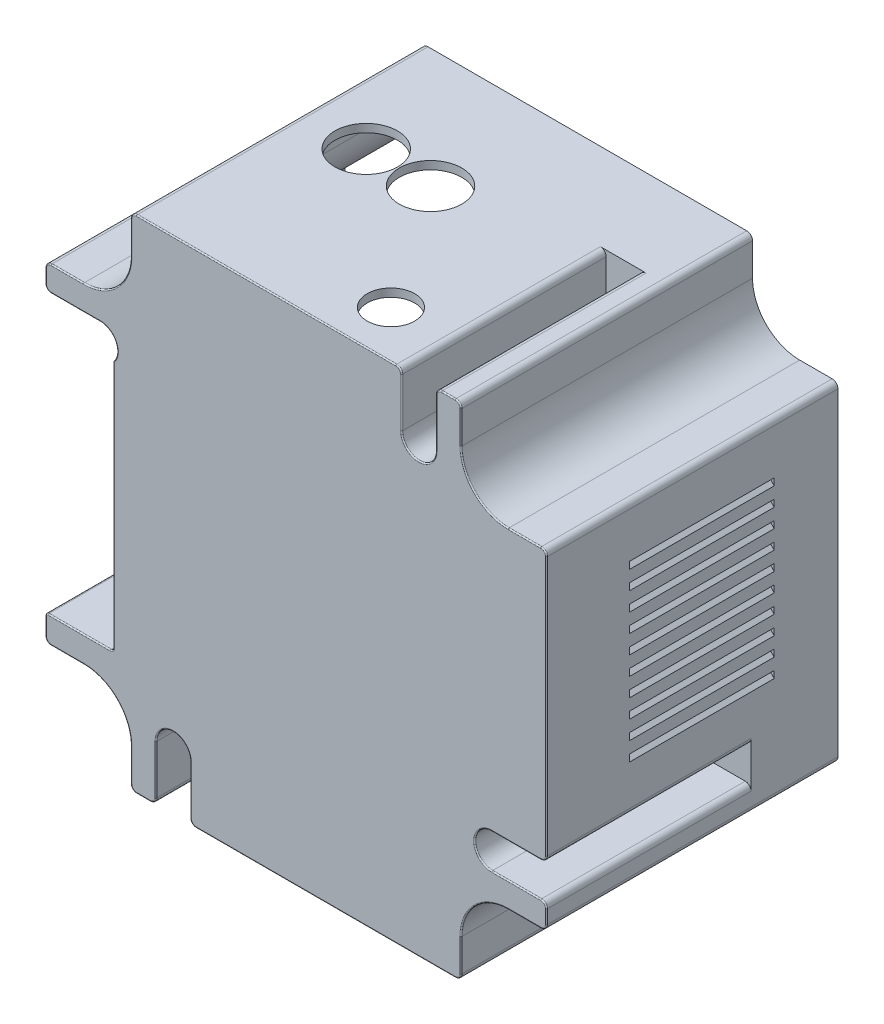
from build123d import *

# Parameters (mm, degrees)
EXTRUDE_1_DEPTH     = 50.3
SHELL_1_T           = -1.4
CUT_EXTRUDE_1_DEPTH = 35.3
EXTRUDE_2_DEPTH     = 35.3
SKETCH_5_R          = 1.65
EXTRUDE_2_2_DEPTH   = 4
CUT_EXTRUDE_2_DEPTH = 25
SKETCH_7_W          = 12.8
SKETCH_7_H          = 44.5
CUT_EXTRUDE_3_DEPTH = 34.3
CUT_EXTRUDE_4_REACH = 111.009
SKETCH_8_R          = 5.4
SKETCH_8_R_2        = 4.1
EXTRUDE_3_REACH     = 96.463
SKETCH_10_W         = 12.8
SKETCH_10_H         = 34
EXTRUDE_5_DEPTH     = 1.1
CUT_EXTRUDE_START   = 35.3
CUT_EXTRUDE_5_DEPTH = 35.3
SKETCH_13_R         = 1.65
CUT_EXTRUDE_7_DEPTH = 71.620216652
CUT_EXTRUDE_6_REACH = 101.978
SKETCH_12_W         = 14.5
SKETCH_12_H         = 12.3
FILLET_1_R          = 0.5
FILLET_3_R          = 0.2
CUT_EXTRUDE_8_DEPTH = 25


with BuildPart() as part:
    # 草图1 → 凸台-拉伸1 (new body)
    with BuildSketch(Plane.XY):
        with BuildLine():
            Line((-27.5, 43.25), (27.5, 43.25))
            ThreePointArc((27.5, 43.25), (28.207106781, 42.957106781), (28.5, 42.25))
            Line((28.5, 42.25), (28.5, 36.65))
            ThreePointArc((28.5, 36.65), (30.887079733, 30.887079733), (36.65, 28.5))
            Line((36.65, 28.5), (42.25, 28.5))
            ThreePointArc((42.25, 28.5), (42.957106781, 28.207106781), (43.25, 27.5))
            Line((43.25, 27.5), (43.25, -27.5))
            ThreePointArc((43.25, -27.5), (42.957106781, -28.207106781), (42.25, -28.5))
            Line((42.25, -28.5), (36.65, -28.5))
            ThreePointArc((36.65, -28.5), (30.887079733, -30.887079733), (28.5, -36.65))
            Line((28.5, -36.65), (28.5, -42.25))
            ThreePointArc((28.5, -42.25), (28.207106781, -42.957106781), (27.5, -43.25))
            Line((27.5, -43.25), (-27.5, -43.25))
            ThreePointArc((-27.5, -43.25), (-28.207106781, -42.957106781), (-28.5, -42.25))
            Line((-28.5, -42.25), (-28.5, -36.65))
            ThreePointArc((-28.5, -36.65), (-30.887079733, -30.887079733), (-36.65, -28.5))
            Line((-36.65, -28.5), (-42.25, -28.5))
            ThreePointArc((-42.25, -28.5), (-42.957106781, -28.207106781), (-43.25, -27.5))
            Line((-43.25, -27.5), (-43.25, 27.5))
            ThreePointArc((-43.25, 27.5), (-42.957106781, 28.207106781), (-42.25, 28.5))
            Line((-42.25, 28.5), (-36.65, 28.5))
            ThreePointArc((-36.65, 28.5), (-30.887079733, 30.887079733), (-28.5, 36.65))
            Line((-28.5, 36.65), (-28.5, 42.25))
            ThreePointArc((-28.5, 42.25), (-28.207106781, 42.957106781), (-27.5, 43.25))
        make_face()
    extrude(amount=EXTRUDE_1_DEPTH)

    # 抽壳1
    shell_1_openings = [part.faces().sort_by_distance(p)[0] for p in [
        (0, 0, 0),
    ]]
    offset(amount=SHELL_1_T, openings=shell_1_openings)

    # 草图2 → 切除-拉伸1 (cut)
    with BuildSketch(Plane.XY.offset(50.3)):
        with BuildLine():
            Line((-33.80515662, 24.14484338), (-42.25, 24.14484338))
            ThreePointArc((-42.25, 24.14484338), (-42.957106781, 24.437736599), (-43.25, 25.14484338))
            Line((-43.25, 25.14484338), (-43.25, 17.24484338))
            ThreePointArc((-43.25, 17.24484338), (-42.957106781, 17.951950161), (-42.25, 18.24484338))
            Line((-42.25, 18.24484338), (-33.80515662, 18.24484338))
            ThreePointArc((-33.80515662, 18.24484338), (-30.85515662, 21.19484338), (-33.80515662, 24.14484338))
        make_face()
        with BuildLine():
            Line((25.14484338, 43.25), (17.24484338, 43.25))
            ThreePointArc((17.24484338, 43.25), (17.951950161, 42.957106781), (18.24484338, 42.25))
            Line((18.24484338, 42.25), (18.24484338, 33.80515662))
            ThreePointArc((18.24484338, 33.80515662), (21.19484338, 30.85515662), (24.14484338, 33.80515662))
            Line((24.14484338, 33.80515662), (24.14484338, 42.25))
            ThreePointArc((24.14484338, 42.25), (24.437736599, 42.957106781), (25.14484338, 43.25))
        make_face()
        with BuildLine():
            Line((43.25, -25.14484338), (43.25, -17.24484338))
            ThreePointArc((43.25, -17.24484338), (42.957106781, -17.951950161), (42.25, -18.24484338))
            Line((42.25, -18.24484338), (33.80515662, -18.24484338))
            ThreePointArc((33.80515662, -18.24484338), (30.85515662, -21.19484338), (33.80515662, -24.14484338))
            Line((33.80515662, -24.14484338), (42.25, -24.14484338))
            ThreePointArc((42.25, -24.14484338), (42.957106781, -24.437736599), (43.25, -25.14484338))
        make_face()
        with BuildLine():
            Line((-25.14484338, -43.25), (-17.24484338, -43.25))
            ThreePointArc((-17.24484338, -43.25), (-17.951950161, -42.957106781), (-18.24484338, -42.25))
            Line((-18.24484338, -42.25), (-18.24484338, -33.80515662))
            ThreePointArc((-18.24484338, -33.80515662), (-21.19484338, -30.85515662), (-24.14484338, -33.80515662))
            Line((-24.14484338, -33.80515662), (-24.14484338, -42.25))
            ThreePointArc((-24.14484338, -42.25), (-24.437736599, -42.957106781), (-25.14484338, -43.25))
        make_face()
    extrude(amount=-CUT_EXTRUDE_1_DEPTH, mode=Mode.SUBTRACT)

    # 草图4 → Extrude 2 (add)
    with BuildSketch(Plane.XY.offset(50.3)):
        with BuildLine():
            Line((-42.25, 18.24484338), (-33.80515662, 18.24484338))
            ThreePointArc((-33.80515662, 18.24484338), (-30.85515662, 21.19484338), (-33.80515662, 24.14484338))
            Line((-33.80515662, 24.14484338), (-42.25, 24.14484338))
            Line((-42.25, 24.14484338), (-42.25, 25.54484338))
            Line((-42.25, 25.54484338), (-33.80515662, 25.54484338))
            ThreePointArc((-33.80515662, 25.54484338), (-29.45515662, 21.19484338), (-33.80515662, 16.84484338))
            Line((-33.80515662, 16.84484338), (-42.25, 16.84484338))
            Line((-42.25, 16.84484338), (-42.25, 18.24484338))
        make_face()
        with BuildLine():
            Line((42.25, -18.24484338), (33.80515662, -18.24484338))
            ThreePointArc((33.80515662, -18.24484338), (30.85515662, -21.19484338), (33.80515662, -24.14484338))
            Line((33.80515662, -24.14484338), (42.25, -24.14484338))
            Line((42.25, -24.14484338), (42.25, -25.54484338))
            Line((42.25, -25.54484338), (33.80515662, -25.54484338))
            ThreePointArc((33.80515662, -25.54484338), (29.45515662, -21.19484338), (33.80515662, -16.84484338))
            Line((33.80515662, -16.84484338), (42.25, -16.84484338))
            Line((42.25, -16.84484338), (42.25, -18.24484338))
        make_face()
        with BuildLine():
            Line((18.24484338, 42.25), (18.24484338, 33.80515662))
            ThreePointArc((18.24484338, 33.80515662), (21.19484338, 30.85515662), (24.14484338, 33.80515662))
            Line((24.14484338, 33.80515662), (24.14484338, 42.25))
            Line((24.14484338, 42.25), (25.54484338, 42.25))
            Line((25.54484338, 42.25), (25.54484338, 33.80515662))
            ThreePointArc((25.54484338, 33.80515662), (21.19484338, 29.45515662), (16.84484338, 33.80515662))
            Line((16.84484338, 33.80515662), (16.84484338, 42.25))
            Line((16.84484338, 42.25), (18.24484338, 42.25))
        make_face()
        with BuildLine():
            Line((-18.24484338, -42.25), (-18.24484338, -33.80515662))
            ThreePointArc((-18.24484338, -33.80515662), (-21.19484338, -30.85515662), (-24.14484338, -33.80515662))
            Line((-24.14484338, -33.80515662), (-24.14484338, -42.25))
            Line((-24.14484338, -42.25), (-25.54484338, -42.25))
            Line((-25.54484338, -42.25), (-25.54484338, -33.80515662))
            ThreePointArc((-25.54484338, -33.80515662), (-21.19484338, -29.45515662), (-16.84484338, -33.80515662))
            Line((-16.84484338, -33.80515662), (-16.84484338, -42.25))
            Line((-16.84484338, -42.25), (-18.24484338, -42.25))
        make_face()
    extrude(amount=-EXTRUDE_2_DEPTH)

    # 草图5 → Extrude 2 2 (add)
    # profile 1 of 4: a face of its own
    with BuildSketch(Plane(origin=(0, 0, 15), x_dir=(-1, 0, 0), z_dir=(0, 0, -1))):
        with BuildLine():
            Line((41.85, 16.84484338), (33.80515662, 16.84484338))
            ThreePointArc((33.80515662, 16.84484338), (29.45515662, 21.19484338), (33.80515662, 25.54484338))
            Line((33.80515662, 25.54484338), (41.85, 25.54484338))
            Line((41.85, 25.54484338), (41.85, 16.84484338))
        make_face()
        with Locations(Location((33.80515662, 21.19484338, 0), (0, 0, 180))):
            Circle(SKETCH_5_R, mode=Mode.SUBTRACT)
    # profile 2 of 4: a face of its own
    with BuildSketch(Plane(origin=(0, 0, 15), x_dir=(-1, 0, 0), z_dir=(0, 0, -1))):
        with BuildLine():
            Line((16.84484338, -41.85), (16.84484338, -33.80515662))
            ThreePointArc((16.84484338, -33.80515662), (21.19484338, -29.45515662), (25.54484338, -33.80515662))
            Line((25.54484338, -33.80515662), (25.54484338, -41.85))
            Line((25.54484338, -41.85), (16.84484338, -41.85))
        make_face()
        with Locations(Location((21.19484338, -33.80515662, 0), (0, 0, 180))):
            Circle(SKETCH_5_R, mode=Mode.SUBTRACT)
    # profile 3 of 4: a face of its own
    with BuildSketch(Plane(origin=(0, 0, 15), x_dir=(-1, 0, 0), z_dir=(0, 0, -1))):
        with BuildLine():
            Line((-41.85, -16.84484338), (-33.80515662, -16.84484338))
            ThreePointArc((-33.80515662, -16.84484338), (-29.45515662, -21.19484338), (-33.80515662, -25.54484338))
            Line((-33.80515662, -25.54484338), (-41.85, -25.54484338))
            Line((-41.85, -25.54484338), (-41.85, -16.84484338))
        make_face()
        with Locations(Location((-33.80515662, -21.19484338, 0), (0, 0, 180))):
            Circle(SKETCH_5_R, mode=Mode.SUBTRACT)
    # profile 4 of 4: a face of its own
    with BuildSketch(Plane(origin=(0, 0, 15), x_dir=(-1, 0, 0), z_dir=(0, 0, -1))):
        with BuildLine():
            Line((-16.84484338, 41.85), (-16.84484338, 33.80515662))
            ThreePointArc((-16.84484338, 33.80515662), (-21.19484338, 29.45515662), (-25.54484338, 33.80515662))
            Line((-25.54484338, 33.80515662), (-25.54484338, 41.85))
            Line((-25.54484338, 41.85), (-16.84484338, 41.85))
        make_face()
        with Locations(Location((-21.19484338, 33.80515662, 0), (0, 0, 180))):
            Circle(SKETCH_5_R, mode=Mode.SUBTRACT)
    extrude(amount=EXTRUDE_2_2_DEPTH)

    # 草图6 → 切除-拉伸2 (cut)
    with BuildSketch(Plane(origin=(0, 0, 11), x_dir=(-1, 0, 0), z_dir=(0, 0, -1))):
        with BuildLine():
            Line((-25.5, -30.5), (25.5, -30.5))
            ThreePointArc((25.5, -30.5), (29.035533906, -29.035533906), (30.5, -25.5))
            Line((30.5, -25.5), (30.5, 25.5))
            ThreePointArc((30.5, 25.5), (29.035533906, 29.035533906), (25.5, 30.5))
            Line((25.5, 30.5), (-25.5, 30.5))
            ThreePointArc((-25.5, 30.5), (-29.035533906, 29.035533906), (-30.5, 25.5))
            Line((-30.5, 25.5), (-30.5, -25.5))
            ThreePointArc((-30.5, -25.5), (-29.035533906, -29.035533906), (-25.5, -30.5))
        make_face()
    extrude(amount=-CUT_EXTRUDE_2_DEPTH, mode=Mode.SUBTRACT)

    # 草图7 → 切除-拉伸3 (cut)
    with BuildSketch(Plane.XY.offset(50.3)):
        with Locations((-36.85, -1.75)):
            Rectangle(SKETCH_7_W, SKETCH_7_H)
    extrude(amount=-CUT_EXTRUDE_3_DEPTH, mode=Mode.SUBTRACT)

    # 草图8 → 切除-拉伸4 (cut, up to next)
    with BuildSketch(Plane(origin=(0, 43.25, 0), x_dir=(1, 0, 0), z_dir=(0, 1, 0)), mode=Mode.PRIVATE) as cut_extrude_4_sk1:
        with Locations(Location((-6.47, -20.6, 0), (0, 0, 270))):
            Circle(SKETCH_8_R)
    cut_extrude_4_tool1 = extrude(cut_extrude_4_sk1.sketch, amount=-CUT_EXTRUDE_4_REACH, mode=Mode.PRIVATE) & part.part
    # 草图8 → 切除-拉伸4 (cut, up to next)
    with BuildSketch(Plane(origin=(0, 43.25, 0), x_dir=(1, 0, 0), z_dir=(0, 1, 0)), mode=Mode.PRIVATE) as cut_extrude_4_sk2:
        with Locations(Location((-17.57, -20.6, 0), (0, 0, 270))):
            Circle(SKETCH_8_R)
    cut_extrude_4_tool2 = extrude(cut_extrude_4_sk2.sketch, amount=-CUT_EXTRUDE_4_REACH, mode=Mode.PRIVATE) & part.part
    # 草图8 → 切除-拉伸4 (cut, up to next)
    with BuildSketch(Plane(origin=(0, 43.25, 0), x_dir=(1, 0, 0), z_dir=(0, 1, 0)), mode=Mode.PRIVATE) as cut_extrude_4_sk3:
        with Locations(Location((8.24484338, -42.15, 0), (0, 0, 270))):
            Circle(SKETCH_8_R_2)
    cut_extrude_4_tool3 = extrude(cut_extrude_4_sk3.sketch, amount=-CUT_EXTRUDE_4_REACH, mode=Mode.PRIVATE) & part.part
    add(cut_extrude_4_tool1.solids().sort_by_distance((-6.47, 43.25, 20.6))[0], mode=Mode.SUBTRACT)
    add(cut_extrude_4_tool2.solids().sort_by_distance((-17.57, 43.25, 20.6))[0], mode=Mode.SUBTRACT)
    add(cut_extrude_4_tool3.solids().sort_by_distance((8.244843, 43.25, 42.15))[0], mode=Mode.SUBTRACT)

    # 凸台-拉伸3: up to this face of the body (flat: up to its plane)
    extrude_3_end = Plane(part.part.faces().sort_by_distance((-30.707993225, 20.5, 33.60414847))[0])
    # 草图9 → 凸台-拉伸3 (add, up to the picked face)
    with BuildSketch(Plane(origin=(0, -24, 0), x_dir=(1, 0, 0), z_dir=(0, 1, 0)), mode=Mode.PRIVATE) as extrude_3_sk1:
        Polygon((-43.25, -14.9), (-43.25, -16), (-31.55, -16), (-31.55, -50.3), (-30.45, -50.3), (-30.45, -14.9), align=None)
    extrude_3_tool1 = split(extrude(extrude_3_sk1.sketch, amount=EXTRUDE_3_REACH, mode=Mode.PRIVATE), bisect_by=extrude_3_end, keep=Keep.BOTH, mode=Mode.PRIVATE)
    add(extrude_3_tool1.solids().sort_by(Axis((-42.873569, -24, 15.45), (0, 1, 0)))[0])

    # 草图10 → 凸台-拉伸5 (add)
    with BuildSketch(Plane(origin=(0, -24, 0), x_dir=(1, 0, 0), z_dir=(0, 1, 0))):
        with Locations((-36.85, -31.9)):
            Rectangle(SKETCH_10_W, SKETCH_10_H)
    extrude(amount=-EXTRUDE_5_DEPTH)

    # 草图11 → 切除-拉伸5 (cut)
    with BuildSketch(Plane.XY.offset(15).offset(CUT_EXTRUDE_START)):
        with BuildLine():
            Line((-42.25, 18.24484338), (-33.80515662, 18.24484338))
            ThreePointArc((-33.80515662, 18.24484338), (-30.85515662, 21.19484338), (-33.80515662, 24.14484338))
            Line((-33.80515662, 24.14484338), (-42.25, 24.14484338))
            ThreePointArc((-42.25, 24.14484338), (-42.957106781, 24.437736599), (-43.25, 25.14484338))
            Line((-43.25, 25.14484338), (-43.25, 17.24484338))
            ThreePointArc((-43.25, 17.24484338), (-42.957106781, 17.951950161), (-42.25, 18.24484338))
        make_face()
    extrude(amount=-CUT_EXTRUDE_5_DEPTH, mode=Mode.SUBTRACT)

    # 草图13 → 切除-拉伸7 (cut, through all)
    with BuildSketch(Plane.XY.offset(15)):
        with Locations((-33.80515662, 21.19484338)):
            Circle(SKETCH_13_R)
    extrude(amount=-CUT_EXTRUDE_7_DEPTH, mode=Mode.SUBTRACT)

    # 草图12 → 切除-拉伸6 (cut, up to next)
    with BuildSketch(Plane.ZY.offset(31.55), mode=Mode.PRIVATE) as cut_extrude_6_sk1:
        with Locations((40.05, 13.35)):
            Rectangle(SKETCH_12_W, SKETCH_12_H)
    cut_extrude_6_tool1 = extrude(cut_extrude_6_sk1.sketch, amount=-CUT_EXTRUDE_6_REACH, mode=Mode.PRIVATE) & part.part
    # 草图12 → 切除-拉伸6 (cut, up to next)
    with BuildSketch(Plane.ZY.offset(31.55), mode=Mode.PRIVATE) as cut_extrude_6_sk2:
        with Locations((40.05, -2.65)):
            Rectangle(SKETCH_12_W, SKETCH_12_H)
    cut_extrude_6_tool2 = extrude(cut_extrude_6_sk2.sketch, amount=-CUT_EXTRUDE_6_REACH, mode=Mode.PRIVATE) & part.part
    # 草图12 → 切除-拉伸6 (cut, up to next)
    with BuildSketch(Plane.ZY.offset(31.55), mode=Mode.PRIVATE) as cut_extrude_6_sk3:
        with BuildLine():
            Line((32.8, -18.9), (32.8, -13.2))
            ThreePointArc((32.8, -13.2), (34.6, -11.4), (36.4, -13.2))
            Line((36.4, -13.2), (36.4, -18.9))
            ThreePointArc((36.4, -18.9), (34.6, -20.7), (32.8, -18.9))
        make_face()
    cut_extrude_6_tool3 = extrude(cut_extrude_6_sk3.sketch, amount=-CUT_EXTRUDE_6_REACH, mode=Mode.PRIVATE) & part.part
    # 草图12 → 切除-拉伸6 (cut, up to next)
    with BuildSketch(Plane.ZY.offset(31.55), mode=Mode.PRIVATE) as cut_extrude_6_sk4:
        with BuildLine():
            Line((20.2, -15.3), (20.2, -9.6))
            ThreePointArc((20.2, -9.6), (22, -7.8), (23.8, -9.6))
            Line((23.8, -9.6), (23.8, -15.3))
            ThreePointArc((23.8, -15.3), (22, -17.1), (20.2, -15.3))
        make_face()
    cut_extrude_6_tool4 = extrude(cut_extrude_6_sk4.sketch, amount=-CUT_EXTRUDE_6_REACH, mode=Mode.PRIVATE) & part.part
    add(cut_extrude_6_tool1.solids().sort_by_distance((-31.55, 13.35, 40.05))[0], mode=Mode.SUBTRACT)
    add(cut_extrude_6_tool2.solids().sort_by_distance((-31.55, -2.65, 40.05))[0], mode=Mode.SUBTRACT)
    add(cut_extrude_6_tool3.solids().sort_by_distance((-31.55, -16.05, 34.6))[0], mode=Mode.SUBTRACT)
    add(cut_extrude_6_tool4.solids().sort_by_distance((-31.55, -12.45, 22))[0], mode=Mode.SUBTRACT)

    # 圆角1
    fillet_1_edges = [part.edges().sort_by_distance(p)[0] for p in [
        (-43.25, -24, 33.15),
        (-31.55, -24, 33.15),
    ]]
    fillet(fillet_1_edges, radius=FILLET_1_R)

    # 圆角3
    fillet_3_edges = [part.edges().sort_by_distance(p)[0] for p in [
        (-30.887079733, 30.887079733, 50.3),
        (5.12757831, -43.25, 50.3),
        (43.25, 5.12757831, 50.3),
        (-5.12757831, 43.25, 50.3),
        (-39.45, 28.5, 50.3),
        (-42.957106781, 24.437736599, 50.3),
        (-38.02757831, 24.14484338, 50.3),
        (24.437736599, 42.957106781, 50.3),
        (17.951950161, 42.957106781, 50.3),
        (18.24484338, 38.02757831, 50.3),
        (21.19484338, 30.85515662, 50.3),
        (24.14484338, 38.02757831, 50.3),
        (42.957106781, -24.437736599, 50.3),
        (42.957106781, -17.951950161, 50.3),
        (38.02757831, -18.24484338, 50.3),
        (30.85515662, -21.19484338, 50.3),
        (38.02757831, -24.14484338, 50.3),
        (-42.957106781, 28.207106781, 50.3),
        (-24.437736599, -42.957106781, 50.3),
        (-17.951950161, -42.957106781, 50.3),
        (-18.24484338, -38.02757831, 50.3),
        (-21.19484338, -30.85515662, 50.3),
        (-24.14484338, -38.02757831, 50.3),
        (-43.25, 26.32242169, 50.3),
        (-42.957106781, -28.207106781, 50.3),
        (-39.45, -28.5, 50.3),
        (-30.887079733, -30.887079733, 50.3),
        (-28.5, -39.45, 50.3),
        (-28.207106781, -42.957106781, 50.3),
        (-26.32242169, -43.25, 50.3),
        (-28.207106781, 42.957106781, 50.3),
        (28.207106781, -42.957106781, 50.3),
        (28.5, -39.45, 50.3),
        (30.887079733, -30.887079733, 50.3),
        (-31.130016238, 22.438275701, 50.3),
        (39.45, -28.5, 50.3),
        (42.957106781, -28.207106781, 50.3),
        (43.25, -26.32242169, 50.3),
        (42.957106781, 28.207106781, 50.3),
        (-31.55, -2.103468501, 50.3),
        (39.45, 28.5, 50.3),
        (30.887079733, 30.887079733, 50.3),
        (28.5, 39.45, 50.3),
        (-37.4, -24, 50.3),
        (-43.25, -26, 50.3),
        (-43.103553391, -24.146446609, 50.3),
        (-31.696446609, -23.853553391, 50.3),
        (-28.5, 39.45, 50.3),
        (28.207106781, 42.957106781, 50.3),
        (26.32242169, 43.25, 50.3),
    ]]
    fillet(fillet_3_edges, radius=FILLET_3_R)

    # 草图14 → 切除-拉伸8 (cut)
    with BuildSketch(Plane.XY.offset(11)):
        Polygon((41.85, 21.1), (43.25, 19.7), (43.25, 18.5), (41.85, 19.9), align=None)
        Polygon((41.85, 17.9), (43.25, 16.5), (43.25, 15.3), (41.85, 16.7), align=None)
        Polygon((41.85, 14.7), (43.25, 13.3), (43.25, 12.1), (41.85, 13.5), align=None)
        Polygon((41.85, 11.5), (43.25, 10.1), (43.25, 8.9), (41.85, 10.3), align=None)
        Polygon((41.85, 8.3), (43.25, 6.9), (43.25, 5.7), (41.85, 7.1), align=None)
        Polygon((41.85, 5.1), (43.25, 3.7), (43.25, 2.5), (41.85, 3.9), align=None)
        Polygon((41.85, 1.9), (43.25, 0.5), (43.25, -0.7), (41.85, 0.7), align=None)
        Polygon((41.85, -1.3), (43.25, -2.7), (43.25, -3.9), (41.85, -2.5), align=None)
        Polygon((41.85, -4.5), (43.25, -5.9), (43.25, -7.1), (41.85, -5.7), align=None)
        Polygon((41.85, -7.7), (43.25, -9.1), (43.25, -10.3), (41.85, -8.9), align=None)
    extrude(amount=CUT_EXTRUDE_8_DEPTH, mode=Mode.SUBTRACT)


solid = part.part
